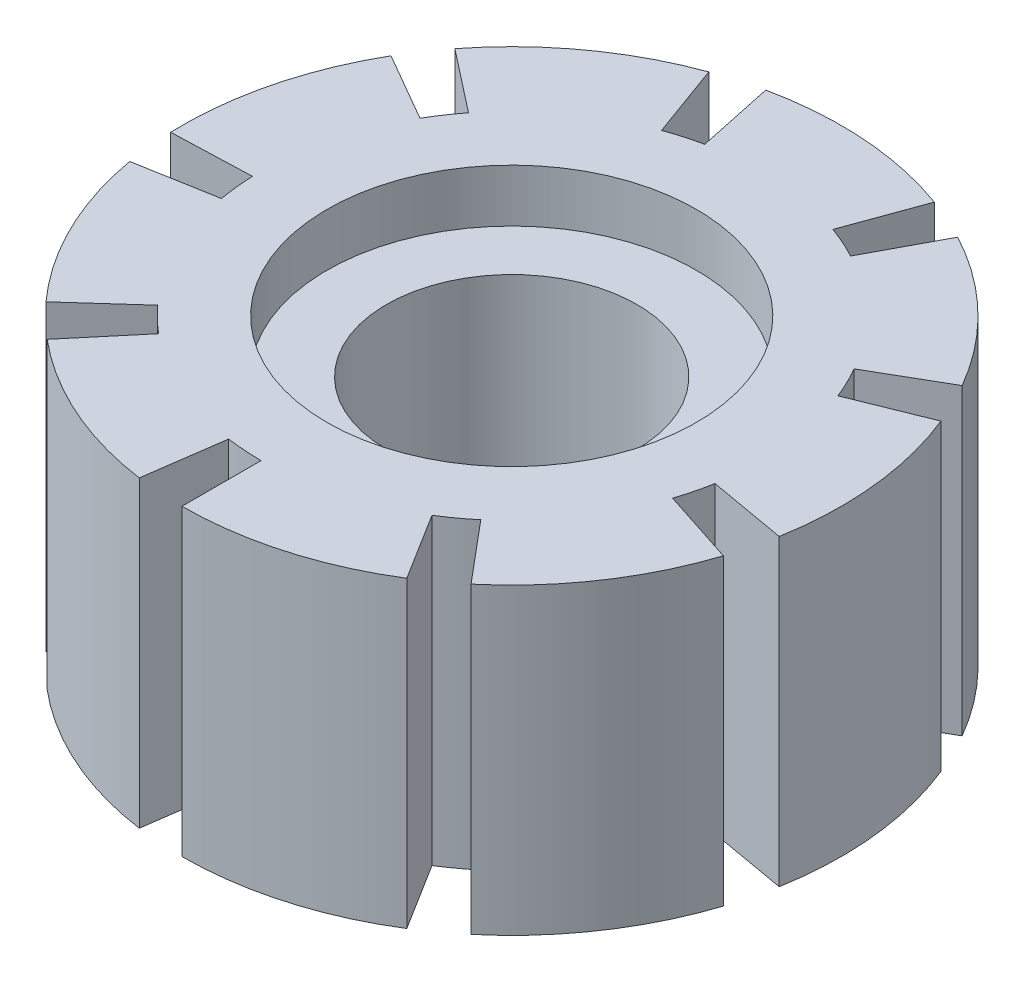
from build123d import *

# Parameters (mm, degrees)
SKETCH1_R           = 25
SKETCH1_R_2         = 9.5
BOSS_EXTRUDE1_DEPTH = 15
SKETCH2_R           = 25
SKETCH2_R_2         = 14
BOSS_EXTRUDE2_DEPTH = 4
CUT_EXTRUDE1_DEPTH  = 43.178193418
CIRPATTERN1_COUNT   = 9


with BuildPart() as part:
    # Sketch1 → Boss-Extrude1 (new body)
    with BuildSketch(Plane(origin=(0, 0, 0), x_dir=(1, 0, 0), z_dir=(0, 1, 0))):
        with Locations(Location((0, 0, 0), (0, 0, 270))):
            Circle(SKETCH1_R)
        with Locations(Location((0, 0, 0), (0, 0, 270))):
            Circle(SKETCH1_R_2, mode=Mode.SUBTRACT)
    extrude(amount=BOSS_EXTRUDE1_DEPTH)

    # Sketch2 → Boss-Extrude2 (add)
    with BuildSketch(Plane(origin=(0, 15, 0), x_dir=(1, 0, 0), z_dir=(0, 1, 0))):
        with Locations(Location((0, 0, 0), (0, 0, 270))):
            Circle(SKETCH2_R)
        with Locations(Location((0, 0, 0), (0, 0, 270))):
            Circle(SKETCH2_R_2, mode=Mode.SUBTRACT)
    boss_extrude2 = extrude(amount=BOSS_EXTRUDE2_DEPTH)

    # Mirror1: Boss-Extrude2 across plane
    add(boss_extrude2.mirror(Plane.ZX.offset(7.5)))

    # Sketch6 → Cut-Extrude1 (cut, through all)
    with BuildSketch(Plane.XZ.offset(4)):
        with BuildLine():
            Line((-3.479327524, 24.756701719), (-2.644288918, 18.815093306))
            ThreePointArc((-2.644288918, 18.815093306), (-1.325373001, 18.953716955), (0, 19))
            Line((0, 19), (0, 25))
            ThreePointArc((0, 25), (-1.743911844, 24.939101256), (-3.479327524, 24.756701719))
        make_face()
    cut_extrude1 = extrude(amount=-CUT_EXTRUDE1_DEPTH, mode=Mode.SUBTRACT)

    # CirPattern1: Cut-Extrude1 ×9 about axis
    cirpattern1_axis = Axis((0, 0, 0), (0, 1, 0))
    for i in range(1, CIRPATTERN1_COUNT):
        add(cut_extrude1.rotate(cirpattern1_axis, i * 360 / CIRPATTERN1_COUNT), mode=Mode.SUBTRACT)


solid = part.part
